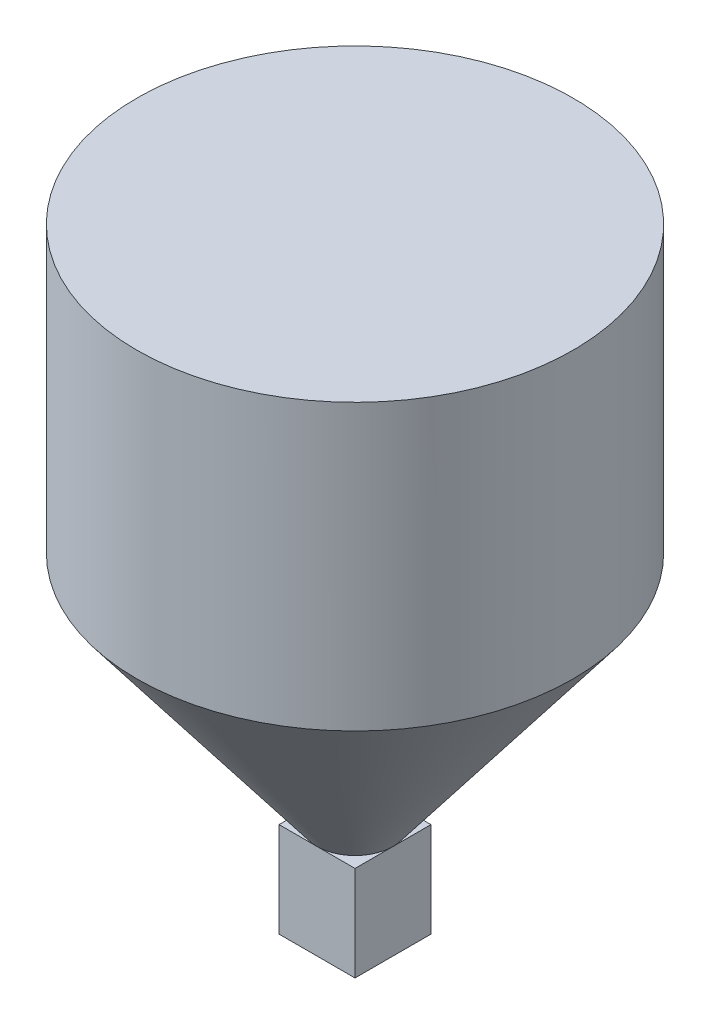
from build123d import *

# Parameters (mm, degrees)
CROQUIS1_R              = 115
SALIENTE_EXTRUIR1_DEPTH = 150
CROQUIS3_R              = 20
CROQUIS2_R              = 115
CROQUIS4_W              = 40
CROQUIS4_H              = 40
SALIENTE_EXTRUIR2_DEPTH = 50


with BuildPart() as part:
    # Croquis1 → Saliente-Extruir1 (new body)
    with BuildSketch(Plane(origin=(0, 0, 0), x_dir=(1, 0, 0), z_dir=(0, 1, 0))):
        with Locations(Location((0, 0, 0), (0, 0, 270))):
            Circle(CROQUIS1_R)
    extrude(amount=-SALIENTE_EXTRUIR1_DEPTH)

    # Croquis3 → Recubrir1 section 0
    with BuildSketch(Plane(origin=(0, -274, 0), x_dir=(1, 0, 0), z_dir=(0, 1, 0))):
        Circle(CROQUIS3_R)
    # Croquis2 → Recubrir1 section 1
    with BuildSketch(Plane.XZ.offset(150)):
        Circle(CROQUIS2_R)
    loft()

    # Croquis4 → Saliente-Extruir2 (add)
    with BuildSketch(Plane.XZ.offset(274)):
        Rectangle(CROQUIS4_W, CROQUIS4_H)
    extrude(amount=SALIENTE_EXTRUIR2_DEPTH)


solid = part.part
